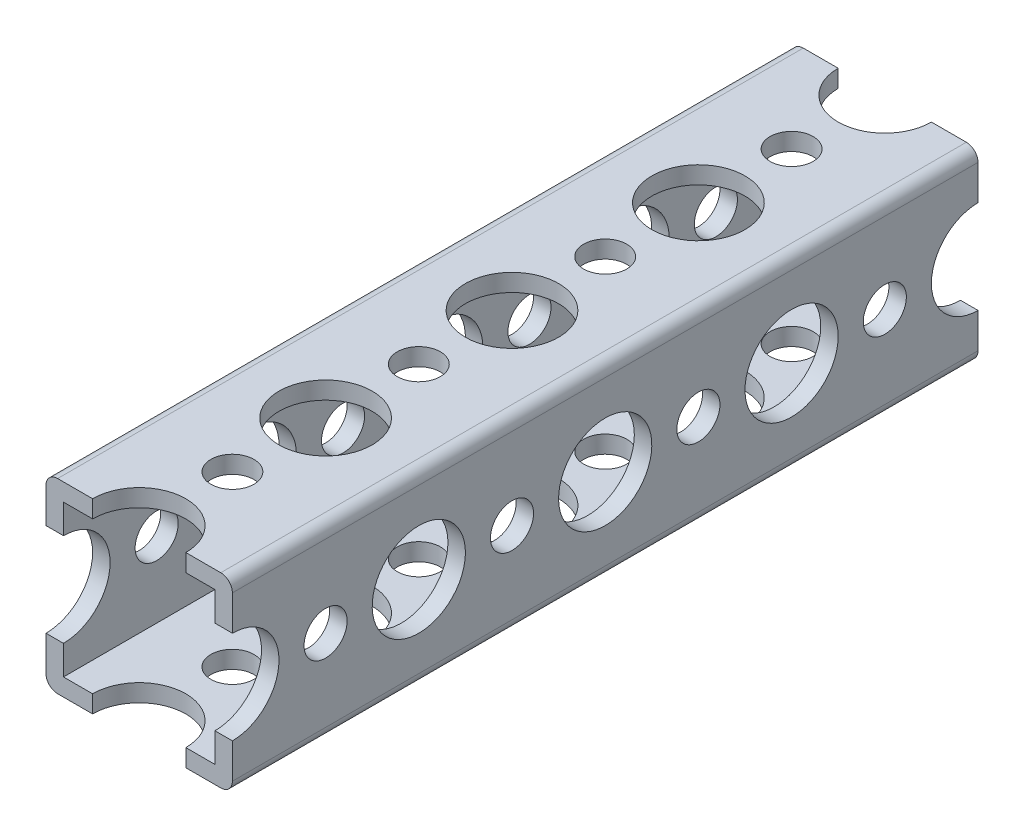
from build123d import *

# Parameters (mm, degrees)
SKETCH1_W      = 16
SKETCH1_H      = 16
EXTRUDE1_DEPTH = 64
SKETCH2_W      = 13
SKETCH2_H      = 13
EXTRUDE2_DEPTH = 68.882250994
SKETCH3_R      = 4
SKETCH3_R_2    = 1.85
EXTRUDE3_DEPTH = 68.882250994
SKETCH4_R      = 4
SKETCH4_R_2    = 1.85
EXTRUDE4_DEPTH = 68.882250994
FILLET1_R      = 1


with BuildPart() as part:
    # Sketch1 → Extrude1 (new body)
    with BuildSketch(Plane.XY):
        with Locations((8, 8)):
            Rectangle(SKETCH1_W, SKETCH1_H)
    extrude(amount=-EXTRUDE1_DEPTH)

    # Sketch2 → Extrude2 (cut, through all)
    with BuildSketch(Plane.XY):
        with Locations((8, 8)):
            Rectangle(SKETCH2_W, SKETCH2_H)
    extrude(amount=-EXTRUDE2_DEPTH, mode=Mode.SUBTRACT)

    # Sketch3 → Extrude3 (cut, through all)
    with BuildSketch(Plane(origin=(0, 16, 0), x_dir=(1, 0, 0), z_dir=(0, 1, 0))):
        with Locations((8, 64)):
            Circle(SKETCH3_R)
        with Locations(Location((8, 32, 0), (0, 0, 270))):
            Circle(SKETCH3_R)
        with Locations((8, 0)):
            Circle(SKETCH3_R)
        with Locations((8, 96)):
            Circle(SKETCH3_R)
        with Locations((8, 128)):
            Circle(SKETCH3_R)
        with Locations((8, 160)):
            Circle(SKETCH3_R)
        with Locations((8, 192)):
            Circle(SKETCH3_R)
        with Locations((8, 224)):
            Circle(SKETCH3_R)
        with Locations((8, 256)):
            Circle(SKETCH3_R)
        with Locations(Location((8, 48, 0), (0, 0, 270))):
            Circle(SKETCH3_R)
        with Locations(Location((8, 56, 0), (0, 0, 270))):
            Circle(SKETCH3_R_2)
        with Locations(Location((8, 40, 0), (0, 0, 270))):
            Circle(SKETCH3_R_2)
        with Locations((8, 80)):
            Circle(SKETCH3_R)
        with Locations((8, 88)):
            Circle(SKETCH3_R_2)
        with Locations((8, 72)):
            Circle(SKETCH3_R_2)
        with Locations(Location((8, 16, 0), (0, 0, 270))):
            Circle(SKETCH3_R)
        with Locations(Location((8, 24, 0), (0, 0, 270))):
            Circle(SKETCH3_R_2)
        with Locations(Location((8, 8, 0), (0, 0, 270))):
            Circle(SKETCH3_R_2)
        with Locations((8, 112)):
            Circle(SKETCH3_R)
        with Locations((8, 120)):
            Circle(SKETCH3_R_2)
        with Locations((8, 104)):
            Circle(SKETCH3_R_2)
        with Locations((8, 144)):
            Circle(SKETCH3_R)
        with Locations((8, 152)):
            Circle(SKETCH3_R_2)
        with Locations((8, 136)):
            Circle(SKETCH3_R_2)
        with Locations((8, 176)):
            Circle(SKETCH3_R)
        with Locations((8, 184)):
            Circle(SKETCH3_R_2)
        with Locations((8, 168)):
            Circle(SKETCH3_R_2)
        with Locations((8, 208)):
            Circle(SKETCH3_R)
        with Locations((8, 216)):
            Circle(SKETCH3_R_2)
        with Locations((8, 200)):
            Circle(SKETCH3_R_2)
        with Locations((8, 240)):
            Circle(SKETCH3_R)
        with Locations((8, 248)):
            Circle(SKETCH3_R_2)
        with Locations((8, 232)):
            Circle(SKETCH3_R_2)
    extrude(amount=-EXTRUDE3_DEPTH, mode=Mode.SUBTRACT)

    # Sketch4 → Extrude4 (cut, through all)
    with BuildSketch(Plane(origin=(16, 0, 0), x_dir=(0, 0, -1), z_dir=(1, 0, 0))):
        with Locations(Location((32, 8, 0), (0, 0, 90))):
            Circle(SKETCH4_R)
        with Locations((64, 8)):
            Circle(SKETCH4_R)
        with Locations((0, 8)):
            Circle(SKETCH4_R)
        with Locations((96, 8)):
            Circle(SKETCH4_R)
        with Locations((128, 8)):
            Circle(SKETCH4_R)
        with Locations((160, 8)):
            Circle(SKETCH4_R)
        with Locations((192, 8)):
            Circle(SKETCH4_R)
        with Locations((224, 8)):
            Circle(SKETCH4_R)
        with Locations((256, 8)):
            Circle(SKETCH4_R)
        with Locations(Location((48, 8.074203, 0), (0, 0, 90))):
            Circle(SKETCH4_R)
        with Locations(Location((40, 8.074203, 0), (0, 0, 90))):
            Circle(SKETCH4_R_2)
        with Locations(Location((56, 8.074203, 0), (0, 0, 90))):
            Circle(SKETCH4_R_2)
        with Locations((80, 8)):
            Circle(SKETCH4_R)
        with Locations((72, 8)):
            Circle(SKETCH4_R_2)
        with Locations((88, 8)):
            Circle(SKETCH4_R_2)
        with Locations(Location((16, 8, 0), (0, 0, 90))):
            Circle(SKETCH4_R)
        with Locations(Location((8, 8, 0), (0, 0, 90))):
            Circle(SKETCH4_R_2)
        with Locations(Location((24, 8, 0), (0, 0, 90))):
            Circle(SKETCH4_R_2)
        with Locations((112, 8)):
            Circle(SKETCH4_R)
        with Locations((104, 8)):
            Circle(SKETCH4_R_2)
        with Locations((120, 8)):
            Circle(SKETCH4_R_2)
        with Locations((144, 8)):
            Circle(SKETCH4_R)
        with Locations((136, 8)):
            Circle(SKETCH4_R_2)
        with Locations((152, 8)):
            Circle(SKETCH4_R_2)
        with Locations((176, 8)):
            Circle(SKETCH4_R)
        with Locations((168, 8)):
            Circle(SKETCH4_R_2)
        with Locations((184, 8)):
            Circle(SKETCH4_R_2)
        with Locations((208, 8)):
            Circle(SKETCH4_R)
        with Locations((200, 8)):
            Circle(SKETCH4_R_2)
        with Locations((216, 8)):
            Circle(SKETCH4_R_2)
        with Locations((240, 8)):
            Circle(SKETCH4_R)
        with Locations((232, 8)):
            Circle(SKETCH4_R_2)
        with Locations((248, 8)):
            Circle(SKETCH4_R_2)
    extrude(amount=-EXTRUDE4_DEPTH, mode=Mode.SUBTRACT)

    # Fillet1
    fillet1_edges = [part.edges().sort_by_distance(p)[0] for p in [
        (0, 16, -32),
        (16, 16, -32),
        (16, 0, -32),
        (0, 0, -32),
    ]]
    fillet(fillet1_edges, radius=FILLET1_R)


solid = part.part
